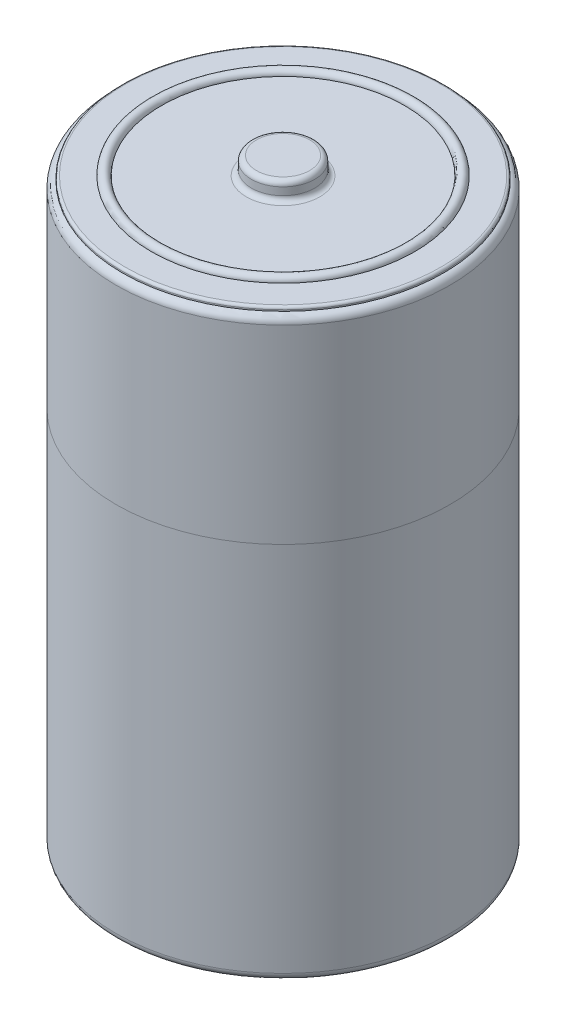
from build123d import *


with BuildPart() as part:
    # Sketch1 → Base-Revolve (revolve)
    with BuildSketch(Plane.XY, mode=Mode.PRIVATE) as base_revolve_sk:
        with BuildLine():
            Line((0, 0), (2.667, 0))
            ThreePointArc((2.667, 0), (3.026210245, -0.148789755), (3.175, -0.508))
            Line((3.175, -0.508), (3.175, -1.27))
            ThreePointArc((3.175, -1.27), (3.323789755, -1.629210245), (3.683, -1.778))
            Line((3.683, -1.778), (12.192, -1.778))
            ThreePointArc((12.192, -1.778), (12.7, -1.27), (13.208, -1.778))
            Line((13.208, -1.778), (15.861, -1.778))
            ThreePointArc((15.861, -1.778), (16.040605122, -1.852394878), (16.115, -2.032))
            Line((16.115, -2.032), (16.115, -2.169657868))
            ThreePointArc((16.115, -2.169657868), (16.569987113, -2.429131115), (16.75, -2.921))
            Line((16.75, -2.921), (16.75, -59.23))
            ThreePointArc((16.75, -59.23), (16.526815367, -59.768815367), (15.988, -59.992))
            Line((15.988, -59.992), (15.100682905, -59.992))
            Line((15.100682905, -59.992), (15.100682905, -60.246))
            Line((15.100682905, -60.246), (11.938, -60.246))
            ThreePointArc((11.938, -60.246), (11.863605122, -60.425605122), (11.684, -60.5))
            Line((11.684, -60.5), (4.064, -60.5))
            ThreePointArc((4.064, -60.5), (3.989605122, -60.320394878), (3.81, -60.246))
            Line((3.81, -60.246), (0, -60.246))
            Line((0, -60.246), (0, 0))
        make_face()
    revolve(base_revolve_sk.sketch.rotate(Axis((0, 0, 0), (0, -1, 0)), 90), axis=Axis((0, 0, 0), (0, -1, 0)))


solid = part.part
